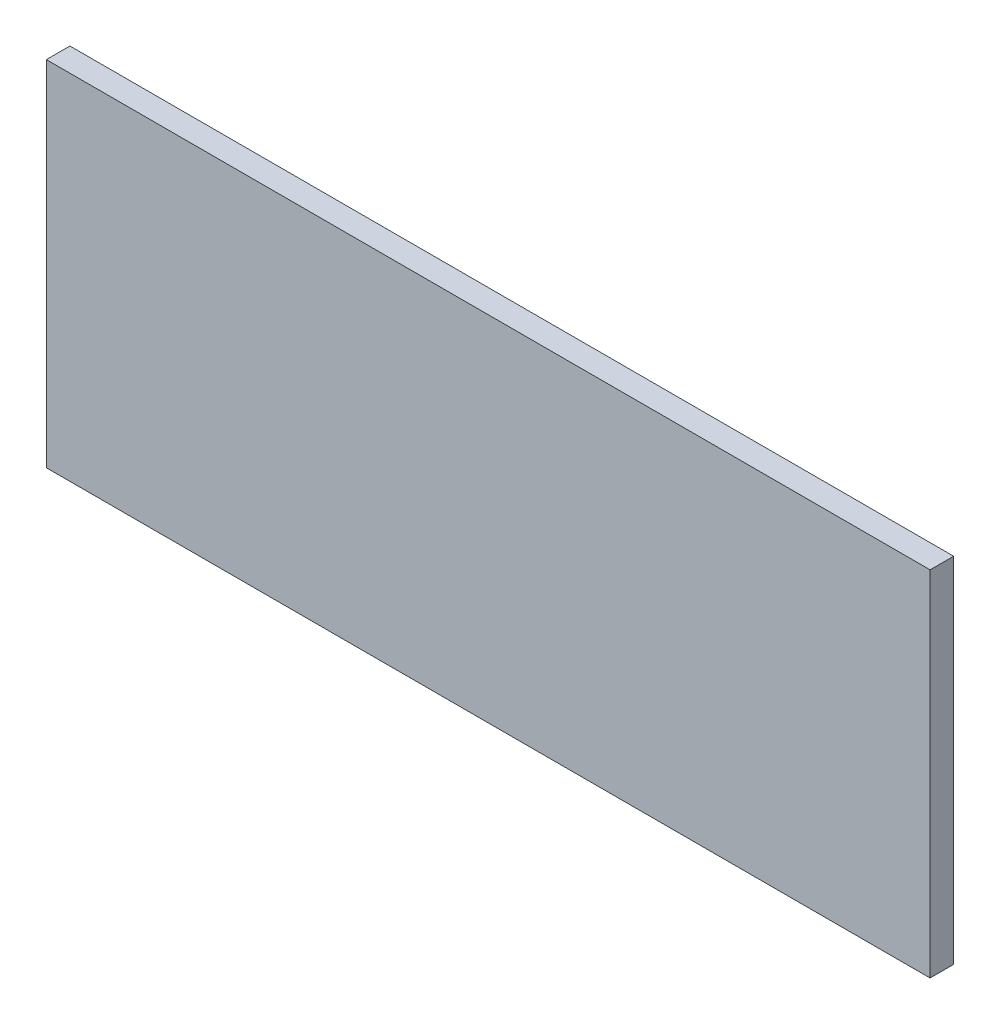
from build123d import *

# Parameters (mm, degrees)
SKETCH1_W           = 4
SKETCH1_H           = 60
BOSS_EXTRUDE1_DEPTH = 75


with BuildPart() as part:
    # Sketch1 → Boss-Extrude1 (new, symmetric)
    with BuildSketch(Plane(origin=(0, 0, 0), x_dir=(0, 0, -1), z_dir=(1, 0, 0))):
        Rectangle(SKETCH1_W, SKETCH1_H)
    extrude(amount=BOSS_EXTRUDE1_DEPTH, both=True)


solid = part.part
